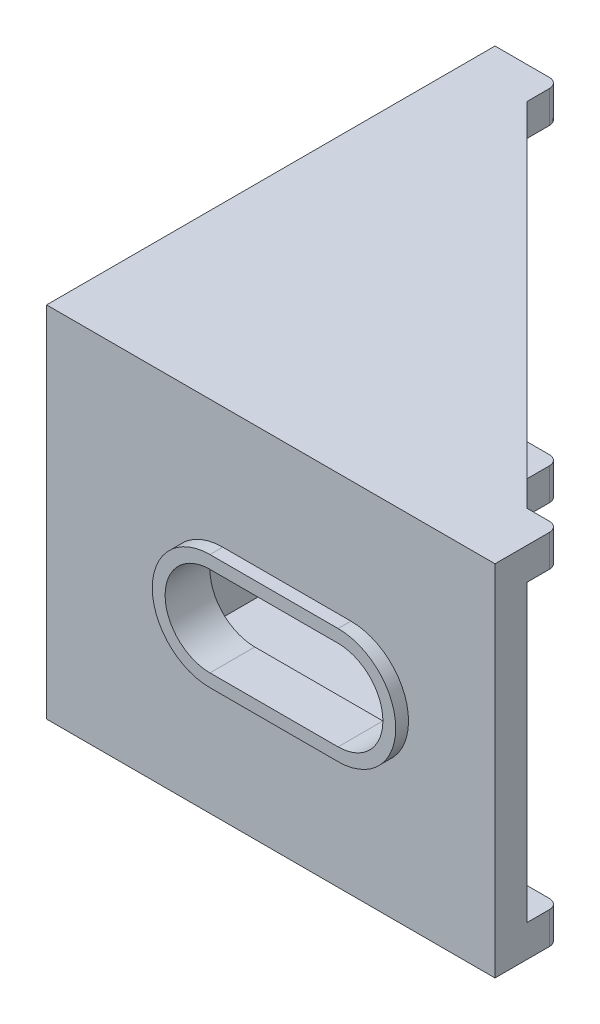
from build123d import *

# Parameters (mm, degrees)
BOSS_EXTRUDE1_DEPTH = 28
BOSS_EXTRUDE2_DEPTH = 2.5
BOSS_EXTRUDE3_START = -25.5
BOSS_EXTRUDE3_DEPTH = 2.5
CUT_EXTRUDE1_DEPTH  = 2.5
CUT_EXTRUDE2_DEPTH  = 2.5
BOSS_EXTRUDE4_DEPTH = 1
BOSS_EXTRUDE5_DEPTH = 1


with BuildPart() as part:
    # Sketch1 → Boss-Extrude1 (new body)
    with BuildSketch(Plane(origin=(0, 0, 0), x_dir=(1, 0, 0), z_dir=(0, 1, 0))):
        Polygon((0, 0), (0, 35), (2.5, 35), (2.5, 2.5), (35, 2.5), (35, 0), align=None)
    extrude(amount=BOSS_EXTRUDE1_DEPTH)

    # Sketch2 → Boss-Extrude2 (add)
    with BuildSketch(Plane(origin=(0, 28, 0), x_dir=(1, 0, 0), z_dir=(0, 1, 0))):
        with BuildLine():
            Line((2.5, 35), (4.25, 35))
            ThreePointArc((4.25, 35), (4.780330086, 34.780330086), (5, 34.25))
            Line((5, 34.25), (5, 32.5))
            Line((5, 32.5), (32.5, 5))
            Line((32.5, 5), (34.25, 5))
            ThreePointArc((34.25, 5), (34.780330086, 4.780330086), (35, 4.25))
            Line((35, 4.25), (35, 2.5))
            Line((35, 2.5), (2.5, 2.5))
            Line((2.5, 2.5), (2.5, 35))
        make_face()
    extrude(amount=-BOSS_EXTRUDE2_DEPTH)

    # Sketch2<2> → Boss-Extrude3 (add)
    with BuildSketch(Plane(origin=(0, 28, 0), x_dir=(1, 0, 0), z_dir=(0, 1, 0)).offset(BOSS_EXTRUDE3_START)):
        with BuildLine():
            Line((2.5, 35), (4.25, 35))
            ThreePointArc((4.25, 35), (4.780330086, 34.780330086), (5, 34.25))
            Line((5, 34.25), (5, 32.5))
            Line((5, 32.5), (32.5, 5))
            Line((32.5, 5), (34.25, 5))
            ThreePointArc((34.25, 5), (34.780330086, 4.780330086), (35, 4.25))
            Line((35, 4.25), (35, 2.5))
            Line((35, 2.5), (2.5, 2.5))
            Line((2.5, 2.5), (2.5, 35))
        make_face()
    extrude(amount=-BOSS_EXTRUDE3_DEPTH)

    # Sketch3 → Cut-Extrude1 (cut)
    with BuildSketch(Plane(origin=(0, 0, -2.5), x_dir=(-1, 0, 0), z_dir=(0, 0, -1))):
        with BuildLine():
            Line((-23.75, 17.5), (-13.75, 17.5))
            ThreePointArc((-13.75, 17.5), (-10.25, 14), (-13.75, 10.5))
            Line((-13.75, 10.5), (-23.75, 10.5))
            ThreePointArc((-23.75, 10.5), (-27.25, 14), (-23.75, 17.5))
        make_face()
    extrude(amount=-CUT_EXTRUDE1_DEPTH, mode=Mode.SUBTRACT)

    # Sketch4 → Cut-Extrude2 (cut)
    with BuildSketch(Plane(origin=(2.5, 0, 0), x_dir=(0, 0, -1), z_dir=(1, 0, 0))):
        with BuildLine():
            Line((13.75, 17.5), (23.75, 17.5))
            ThreePointArc((23.75, 17.5), (27.25, 14), (23.75, 10.5))
            Line((23.75, 10.5), (13.75, 10.5))
            ThreePointArc((13.75, 10.5), (10.25, 14), (13.75, 17.5))
        make_face()
    extrude(amount=-CUT_EXTRUDE2_DEPTH, mode=Mode.SUBTRACT)

    # Sketch5 → Boss-Extrude4 (add)
    with BuildSketch(Plane.XY):
        with BuildLine():
            Line((13.75, 18.5), (23.75, 18.5))
            ThreePointArc((23.75, 18.5), (28.25, 14), (23.75, 9.5))
            Line((23.75, 9.5), (13.75, 9.5))
            ThreePointArc((13.75, 9.5), (9.25, 14), (13.75, 18.5))
        make_face()
        with BuildLine():
            Line((13.75, 17.5), (23.75, 17.5))
            ThreePointArc((23.75, 17.5), (27.25, 14), (23.75, 10.5))
            Line((23.75, 10.5), (13.75, 10.5))
            ThreePointArc((13.75, 10.5), (10.25, 14), (13.75, 17.5))
        make_face(mode=Mode.SUBTRACT)
    extrude(amount=BOSS_EXTRUDE4_DEPTH)

    # Sketch6 → Boss-Extrude5 (add)
    with BuildSketch(Plane.ZY):
        with BuildLine():
            Line((-23.75, 18.5), (-13.75, 18.5))
            ThreePointArc((-13.75, 18.5), (-9.25, 14), (-13.75, 9.5))
            Line((-13.75, 9.5), (-23.75, 9.5))
            ThreePointArc((-23.75, 9.5), (-28.25, 14), (-23.75, 18.5))
        make_face()
        with BuildLine():
            Line((-13.75, 10.5), (-23.75, 10.5))
            ThreePointArc((-23.75, 10.5), (-27.25, 14), (-23.75, 17.5))
            Line((-23.75, 17.5), (-13.75, 17.5))
            ThreePointArc((-13.75, 17.5), (-10.25, 14), (-13.75, 10.5))
        make_face(mode=Mode.SUBTRACT)
    extrude(amount=BOSS_EXTRUDE5_DEPTH)


solid = part.part
